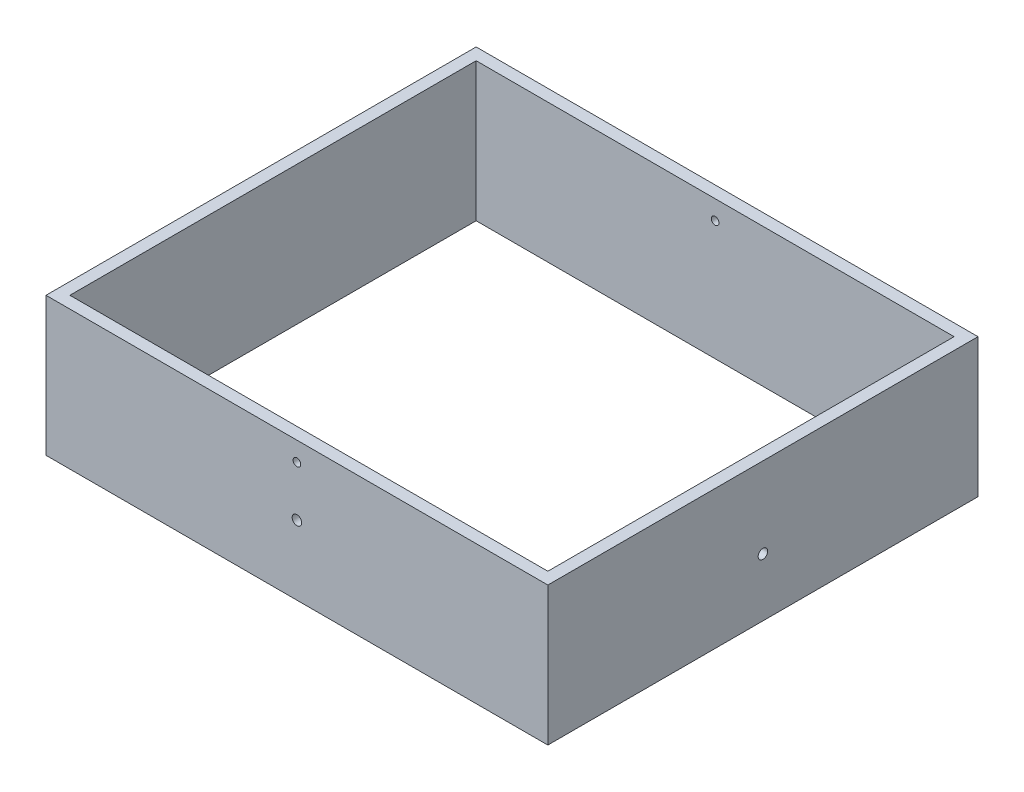
from build123d import *

# Parameters (mm, degrees)
SKETCH1_W           = 333.375
SKETCH1_H           = 285.75
SKETCH1_W_2         = 317.5
SKETCH1_H_2         = 269.875
BOSS_EXTRUDE1_DEPTH = 92.075
SKETCH2_R           = 2.54
CUT_EXTRUDE1_DEPTH  = 369.90049146
SKETCH3_R           = 3.175
CUT_EXTRUDE2_DEPTH  = 7.9375
SKETCH4_R           = 3.175
CUT_EXTRUDE3_DEPTH  = 7.9375


with BuildPart() as part:
    # Sketch1 → Boss-Extrude1 (new body)
    with BuildSketch(Plane(origin=(0, 0, 0), x_dir=(1, 0, 0), z_dir=(0, 1, 0))):
        with Locations((47.68764892, -69.90555659)):
            Rectangle(SKETCH1_W, SKETCH1_H)
        with Locations((47.68764892, -69.90555659)):
            Rectangle(SKETCH1_W_2, SKETCH1_H_2, mode=Mode.SUBTRACT)
    extrude(amount=BOSS_EXTRUDE1_DEPTH)

    # Sketch2 → Cut-Extrude1 (cut, through all)
    with BuildSketch(Plane.XY.offset(212.78055659)):
        with Locations((47.68764892, 79.375)):
            Circle(SKETCH2_R)
    extrude(amount=-CUT_EXTRUDE1_DEPTH, mode=Mode.SUBTRACT)

    # Sketch3 → Cut-Extrude2 (cut)
    with BuildSketch(Plane.XY.offset(212.78055659)):
        with Locations((47.68764892, 46.0375)):
            Circle(SKETCH3_R)
    extrude(amount=-CUT_EXTRUDE2_DEPTH, mode=Mode.SUBTRACT)

    # Sketch4 → Cut-Extrude3 (cut)
    with BuildSketch(Plane(origin=(214.37514892, 0, 0), x_dir=(0, 0, -1), z_dir=(1, 0, 0))):
        with Locations((-69.90555659, 38.559584582)):
            Circle(SKETCH4_R)
    extrude(amount=-CUT_EXTRUDE3_DEPTH, mode=Mode.SUBTRACT)


solid = part.part
